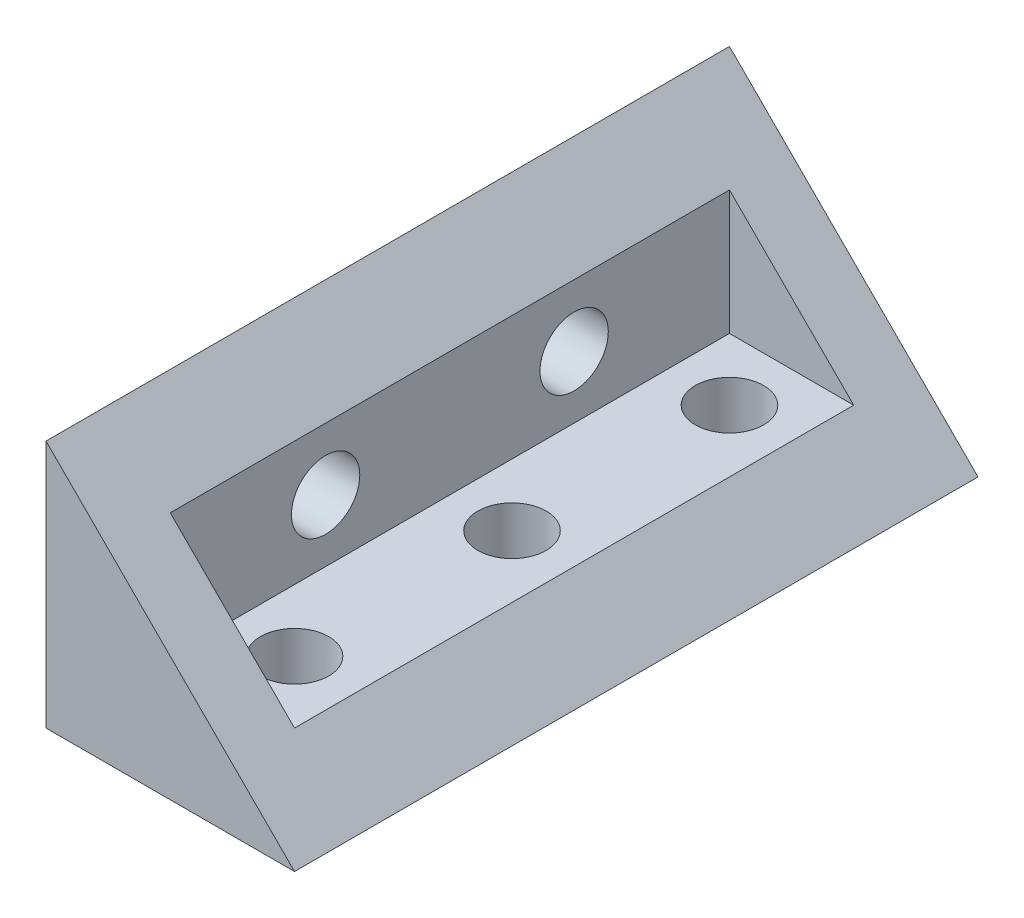
from build123d import *

# Parameters (mm, degrees)
BOSS_EXTRU_1_DEPTH      = 5
BOSS_EXTRU_2_DEPTH      = 45
BOSS_EXTRU_3_DEPTH      = 5
ENL_V_MAT_EXTRU_1_REACH = 60.268
ESQUISSE4_R             = 2.75
ENL_V_MAT_EXTRU_2_REACH = 60.631
ESQUISSE5_R             = 2.75


with BuildPart() as part:
    # Esquisse1 → Boss.-Extru.1 (new body)
    with BuildSketch(Plane.XY):
        Polygon((-13.694471154, 7.95), (6.305528846, -12.05), (-13.694471154, -12.05), align=None)
    extrude(amount=BOSS_EXTRU_1_DEPTH)

    # Esquisse2 → Boss.-Extru.2 (add)
    with BuildSketch(Plane.XY.offset(5)):
        Polygon((-13.694471154, -12.05), (6.305528846, -12.05), (1.305528846, -7.05), (-8.694471154, -7.05), (-8.694471154, 2.95), (-13.694471154, 7.95), align=None)
    extrude(amount=BOSS_EXTRU_2_DEPTH)

    # Esquisse3 → Boss.-Extru.3 (add)
    with BuildSketch(Plane.XY.offset(50)):
        Polygon((-13.694471154, 7.95), (6.305528846, -12.05), (-13.694471154, -12.05), align=None)
    extrude(amount=BOSS_EXTRU_3_DEPTH)

    # Esquisse4 → Enlèv. mat.-Extru.1 (cut, up to next)
    with BuildSketch(Plane(origin=(-8.694471154, 0, 0), x_dir=(0, 0, -1), z_dir=(1, 0, 0)), mode=Mode.PRIVATE) as enl_v_mat_extru_1_sk1:
        with Locations((-17.5, -2.05)):
            Circle(ESQUISSE4_R)
    enl_v_mat_extru_1_tool1 = extrude(enl_v_mat_extru_1_sk1.sketch, amount=-ENL_V_MAT_EXTRU_1_REACH, mode=Mode.PRIVATE) & part.part
    # Esquisse4 → Enlèv. mat.-Extru.1 (cut, up to next)
    with BuildSketch(Plane(origin=(-8.694471154, 0, 0), x_dir=(0, 0, -1), z_dir=(1, 0, 0)), mode=Mode.PRIVATE) as enl_v_mat_extru_1_sk2:
        with Locations((-37.5, -2.05)):
            Circle(ESQUISSE4_R)
    enl_v_mat_extru_1_tool2 = extrude(enl_v_mat_extru_1_sk2.sketch, amount=-ENL_V_MAT_EXTRU_1_REACH, mode=Mode.PRIVATE) & part.part
    add(enl_v_mat_extru_1_tool1.solids().sort_by_distance((-8.694471, -2.05, 17.5))[0], mode=Mode.SUBTRACT)
    add(enl_v_mat_extru_1_tool2.solids().sort_by_distance((-8.694471, -2.05, 37.5))[0], mode=Mode.SUBTRACT)

    # Esquisse5 → Enlèv. mat.-Extru.2 (cut, up to next)
    with BuildSketch(Plane(origin=(0, -7.05, 0), x_dir=(1, 0, 0), z_dir=(0, 1, 0)), mode=Mode.PRIVATE) as enl_v_mat_extru_2_sk1:
        with Locations(Location((-3.694471154, -45, 0), (0, 0, 180))):
            Circle(ESQUISSE5_R)
    enl_v_mat_extru_2_tool1 = extrude(enl_v_mat_extru_2_sk1.sketch, amount=-ENL_V_MAT_EXTRU_2_REACH, mode=Mode.PRIVATE) & part.part
    # Esquisse5 → Enlèv. mat.-Extru.2 (cut, up to next)
    with BuildSketch(Plane(origin=(0, -7.05, 0), x_dir=(1, 0, 0), z_dir=(0, 1, 0)), mode=Mode.PRIVATE) as enl_v_mat_extru_2_sk2:
        with Locations(Location((-3.694471154, -27.5, 0), (0, 0, 180))):
            Circle(ESQUISSE5_R)
    enl_v_mat_extru_2_tool2 = extrude(enl_v_mat_extru_2_sk2.sketch, amount=-ENL_V_MAT_EXTRU_2_REACH, mode=Mode.PRIVATE) & part.part
    # Esquisse5 → Enlèv. mat.-Extru.2 (cut, up to next)
    with BuildSketch(Plane(origin=(0, -7.05, 0), x_dir=(1, 0, 0), z_dir=(0, 1, 0)), mode=Mode.PRIVATE) as enl_v_mat_extru_2_sk3:
        with Locations(Location((-3.694471154, -10, 0), (0, 0, 180))):
            Circle(ESQUISSE5_R)
    enl_v_mat_extru_2_tool3 = extrude(enl_v_mat_extru_2_sk3.sketch, amount=-ENL_V_MAT_EXTRU_2_REACH, mode=Mode.PRIVATE) & part.part
    add(enl_v_mat_extru_2_tool1.solids().sort_by_distance((-3.694471, -7.05, 45))[0], mode=Mode.SUBTRACT)
    add(enl_v_mat_extru_2_tool2.solids().sort_by_distance((-3.694471, -7.05, 27.5))[0], mode=Mode.SUBTRACT)
    add(enl_v_mat_extru_2_tool3.solids().sort_by_distance((-3.694471, -7.05, 10))[0], mode=Mode.SUBTRACT)


solid = part.part
